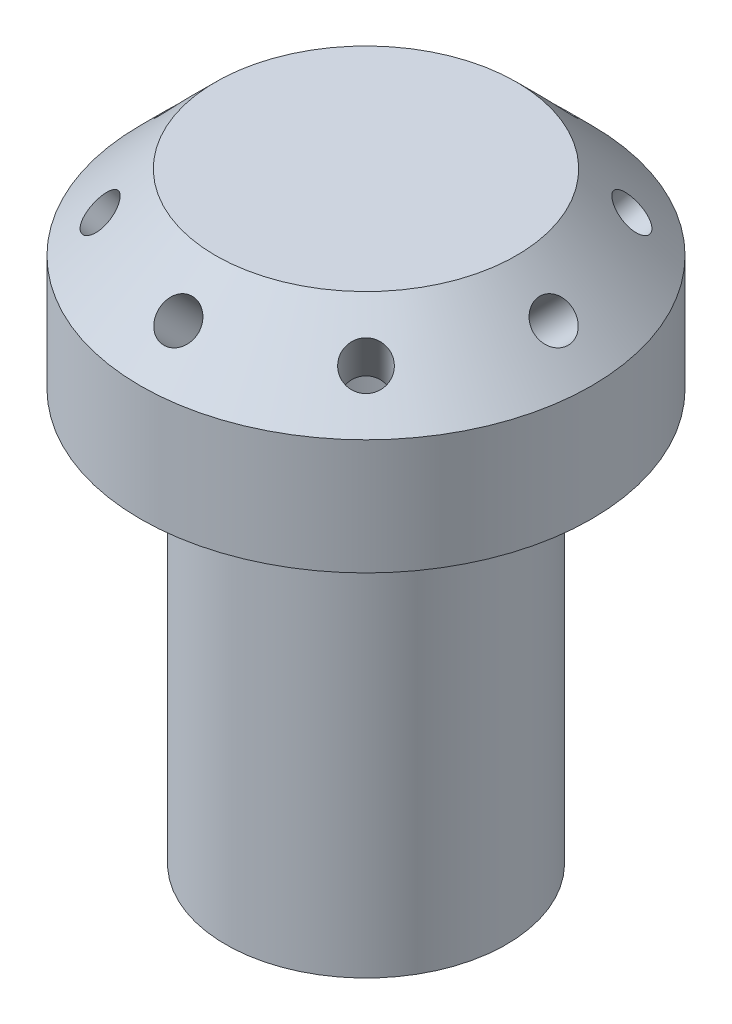
from build123d import *

# Parameters (mm, degrees)
CUT_EXTRUDE1_REACH      = 96.293
CUT_EXTRUDE1_END_RADIUS = 12.7
SKETCH3_R               = 2.54
CIRPATTERN1_COUNT       = 8


with BuildPart() as part:
    # Sketch1 → Revolve1 (revolve)
    with BuildSketch(Plane.XY, mode=Mode.PRIVATE) as revolve1_sk:
        with BuildLine():
            Line((0, 76.2), (0, 61.595))
            ThreePointArc((0, 61.595), (8.980256121, 57.875256121), (12.7, 48.895))
            Line((12.7, 48.895), (12.7, 0))
            Line((12.7, 0), (17.78, 0))
            Line((17.78, 0), (17.78, 52.07))
            Line((17.78, 52.07), (28.575, 52.07))
            Line((28.575, 52.07), (28.575, 66.675))
            Line((28.575, 66.675), (19.05, 76.2))
            Line((19.05, 76.2), (0, 76.2))
        make_face()
    revolve(revolve1_sk.sketch.rotate(Axis((0, 0, 0), (0, 1, 0)), 90), axis=Axis((0, 0, 0), (0, 1, 0)))

    # Cut-Extrude1: up to this sphere (the profile starts outside it)
    cut_extrude1_end = Location((0, 48.895, 0)) * Sphere(CUT_EXTRUDE1_END_RADIUS, mode=Mode.PRIVATE)
    # Sketch3 → Cut-Extrude1 (cut, up to the surface)
    with BuildSketch(Plane(origin=(47.625, 47.625, 0), x_dir=(0.707106781186549, -0.7071067811865461, 0), z_dir=(0.7071067811865461, 0.707106781186549, 0)), mode=Mode.PRIVATE) as cut_extrude1_sk1:
        with Locations(Location((-33.675960454, 0, 0), (0, 0, 180.000000055))):
            Circle(SKETCH3_R)
    cut_extrude1_tool1 = extrude(cut_extrude1_sk1.sketch, amount=-CUT_EXTRUDE1_REACH, mode=Mode.PRIVATE) - cut_extrude1_end
    cut_extrude1 = cut_extrude1_tool1.solids().sort_by_distance((23.8125, 71.4375, 0))[0]
    add(cut_extrude1, mode=Mode.SUBTRACT)

    # CirPattern1: Cut-Extrude1 ×8 about axis
    cirpattern1_axis = Axis((0, 0, 0), (0, -1, 0))
    for i in range(1, CIRPATTERN1_COUNT):
        add(cut_extrude1.rotate(cirpattern1_axis, i * 360 / CIRPATTERN1_COUNT), mode=Mode.SUBTRACT)


solid = part.part
